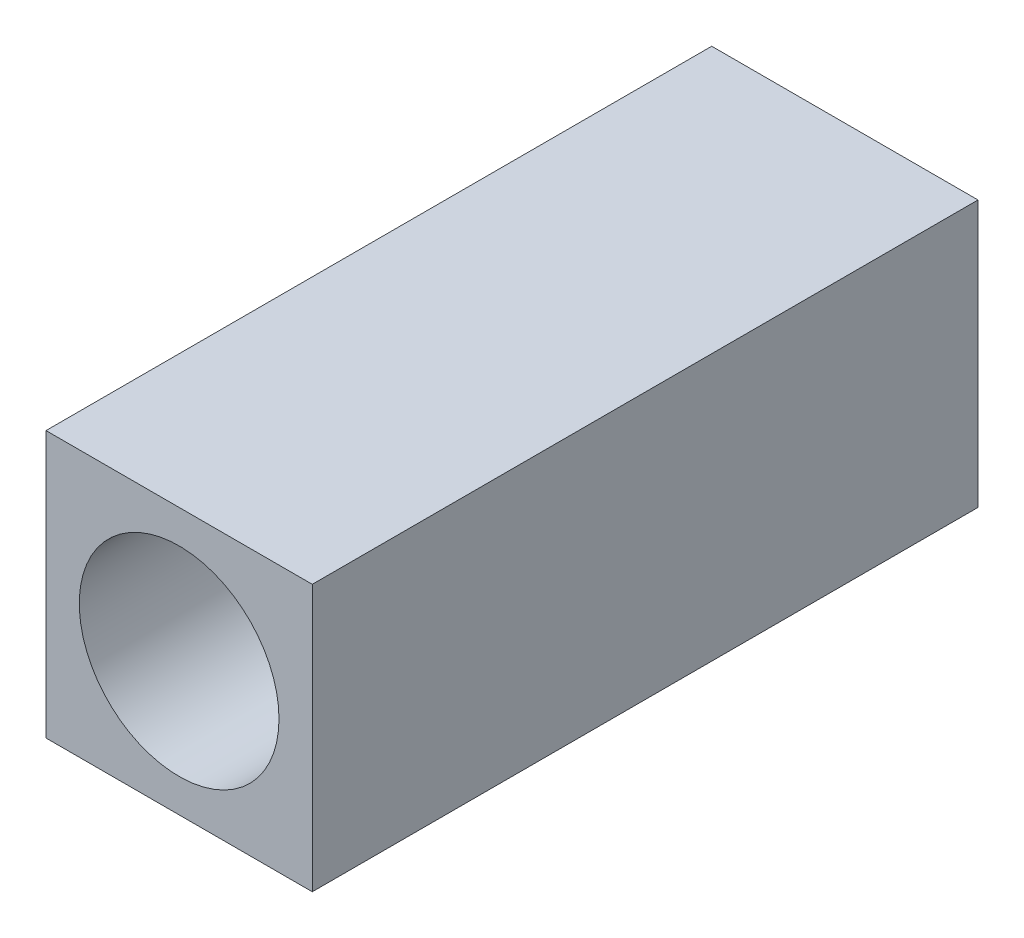
from build123d import *

# Parameters (mm, degrees)
SKETCH1_W           = 80
SKETCH1_H           = 80
SKETCH1_R           = 30
BOSS_EXTRUDE1_DEPTH = 100


with BuildPart() as part:
    # Sketch1 → Boss-Extrude1 (new, symmetric)
    with BuildSketch(Plane.XY):
        Rectangle(SKETCH1_W, SKETCH1_H)
        Circle(SKETCH1_R, mode=Mode.SUBTRACT)
    extrude(amount=BOSS_EXTRUDE1_DEPTH, both=True)


solid = part.part
